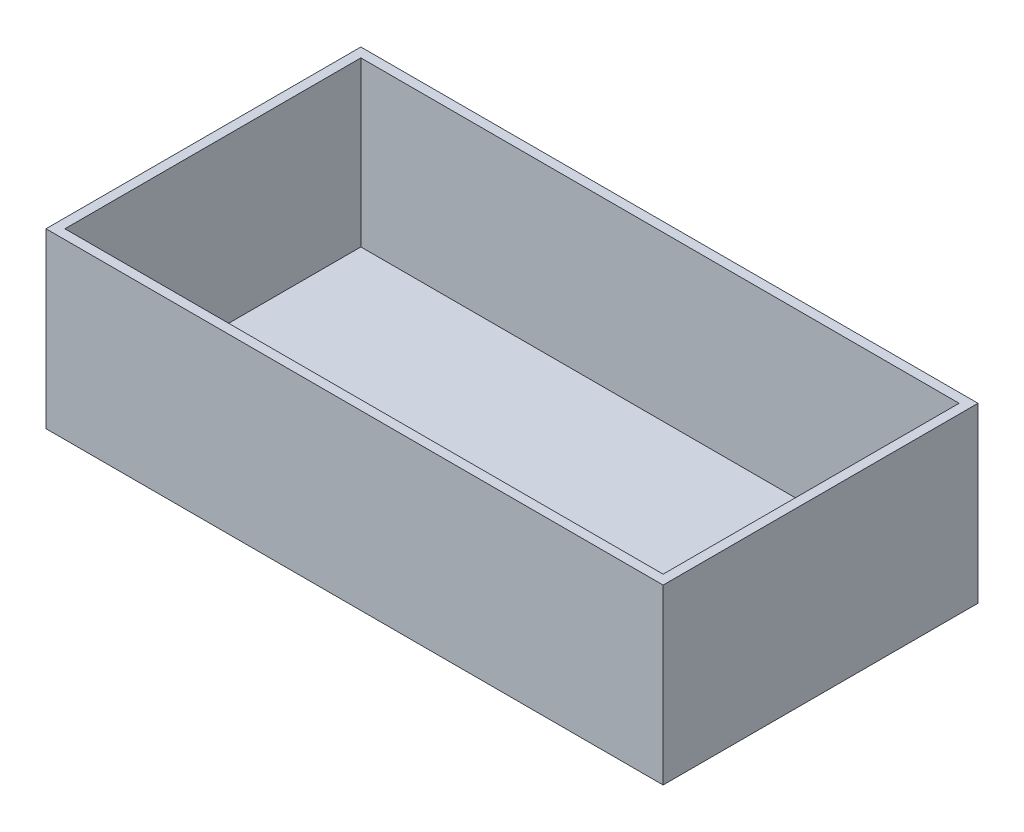
from build123d import *

# Parameters (mm, degrees)
SKETCH1_W           = 196
SKETCH1_H           = 100
BOSS_EXTRUDE1_DEPTH = 55
SKETCH2_W           = 190
SKETCH2_H           = 94
CUT_EXTRUDE1_DEPTH  = 52


with BuildPart() as part:
    # Sketch1 → Boss-Extrude1 (new body)
    with BuildSketch(Plane(origin=(0, 0, 0), x_dir=(1, 0, 0), z_dir=(0, 1, 0))):
        Rectangle(SKETCH1_W, SKETCH1_H)
    extrude(amount=BOSS_EXTRUDE1_DEPTH)

    # Sketch2 → Cut-Extrude1 (cut)
    with BuildSketch(Plane(origin=(0, 55, 0), x_dir=(1, 0, 0), z_dir=(0, 1, 0))):
        Rectangle(SKETCH2_W, SKETCH2_H)
    extrude(amount=-CUT_EXTRUDE1_DEPTH, mode=Mode.SUBTRACT)


solid = part.part
